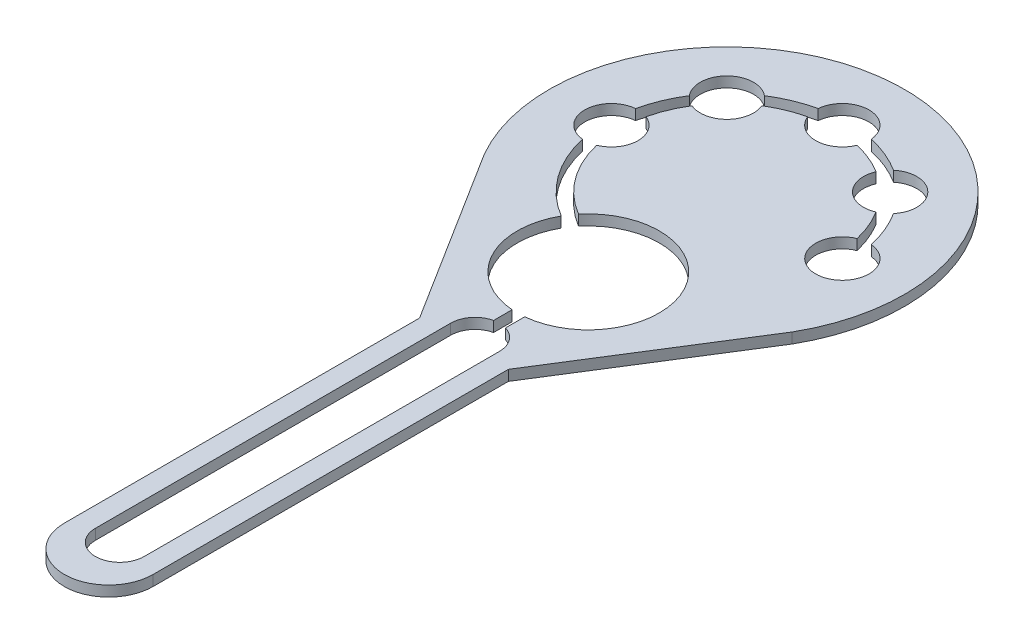
from build123d import *

# Parameters (mm, degrees)
BOSS_EXTRUDE1_DEPTH = 2.9972
SKETCH2_R           = 7.62
CUT_EXTRUDE1_DEPTH  = 197.198393122
CUT_EXTRUDE2_DEPTH  = 197.198393122
SKETCH4_R           = 20.32
CUT_EXTRUDE3_DEPTH  = 197.198393122
CUT_EXTRUDE4_DEPTH  = 197.198393122
SKETCH6_W           = 3.556
SKETCH6_H           = 9.751681081
CUT_EXTRUDE5_DEPTH  = 197.198393122


with BuildPart() as part:
    # Sketch1 → Boss-Extrude1 (new body)
    with BuildSketch(Plane(origin=(0, 0, 0), x_dir=(1, 0, 0), z_dir=(0, 1, 0))):
        with BuildLine():
            Line((12.7, -75.184), (12.7, -176.784))
            ThreePointArc((12.7, -176.784), (0, -189.484), (-12.7, -176.784))
            Line((-12.7, -176.784), (-12.7, -75.184))
            Line((-12.7, -75.184), (-44.026400327, -25.343955378))
            ThreePointArc((-44.026400327, -25.343955378), (0, 50.8), (44.026400327, -25.343955378))
            Line((44.026400327, -25.343955378), (12.7, -75.184))
        make_face()
    extrude(amount=BOSS_EXTRUDE1_DEPTH)

    # Sketch2 → Cut-Extrude1 (cut, through all)
    with BuildSketch(Plane(origin=(0, 2.9972, 0), x_dir=(1, 0, 0), z_dir=(0, 1, 0))):
        with Locations(Location((-33.02, 0, 0), (0, 0, 270))):
            Circle(SKETCH2_R)
        with Locations(Location((-23.348665915, 23.348665915, 0), (0, 0, 270))):
            Circle(SKETCH2_R)
        with Locations(Location((0, 33.02, 0), (0, 0, 270))):
            Circle(SKETCH2_R)
        with Locations(Location((23.348665915, 23.348665915, 0), (0, 0, 270))):
            Circle(SKETCH2_R)
        with Locations(Location((33.02, 0, 0), (0, 0, 270))):
            Circle(SKETCH2_R)
    extrude(amount=-CUT_EXTRUDE1_DEPTH, mode=Mode.SUBTRACT)

    # Sketch3 → Cut-Extrude2 (cut, through all)
    with BuildSketch(Plane(origin=(0, 2.9972, 0), x_dir=(1, 0, 0), z_dir=(0, 1, 0))):
        with BuildLine():
            Line((-15.316948027, -30.962542518), (-1.255828352, -30.962542518))
            ThreePointArc((-1.255828352, -30.962542518), (-21.463230594, 22.351417773), (30.988, 0))
            Line((30.988, 0), (34.544, 0))
            ThreePointArc((34.544, 0), (-18.223326856, 29.346180234), (-15.316948027, -30.962542518))
        make_face()
    extrude(amount=-CUT_EXTRUDE2_DEPTH, mode=Mode.SUBTRACT)

    # Sketch4 → Cut-Extrude3 (cut, through all)
    with BuildSketch(Plane(origin=(0, 2.9972, 0), x_dir=(1, 0, 0), z_dir=(0, 1, 0))):
        with Locations((0, -39.624)):
            Circle(SKETCH4_R)
    extrude(amount=-CUT_EXTRUDE3_DEPTH, mode=Mode.SUBTRACT)

    # Sketch5 → Cut-Extrude4 (cut, through all)
    with BuildSketch(Plane(origin=(0, 2.9972, 0), x_dir=(1, 0, 0), z_dir=(0, 1, 0))):
        with BuildLine():
            Line((6.985, -72.009), (6.985, -173.609))
            ThreePointArc((6.985, -173.609), (0, -180.594), (-6.985, -173.609))
            Line((-6.985, -173.609), (-6.985, -72.009))
            ThreePointArc((-6.985, -72.009), (0, -65.024), (6.985, -72.009))
        make_face()
    extrude(amount=-CUT_EXTRUDE4_DEPTH, mode=Mode.SUBTRACT)

    # Sketch6 → Cut-Extrude5 (cut, through all)
    with BuildSketch(Plane(origin=(0, 2.9972, 0), x_dir=(1, 0, 0), z_dir=(0, 1, 0))):
        with Locations((0.254, -62.435855584)):
            Rectangle(SKETCH6_W, SKETCH6_H)
    extrude(amount=-CUT_EXTRUDE5_DEPTH, mode=Mode.SUBTRACT)


solid = part.part
